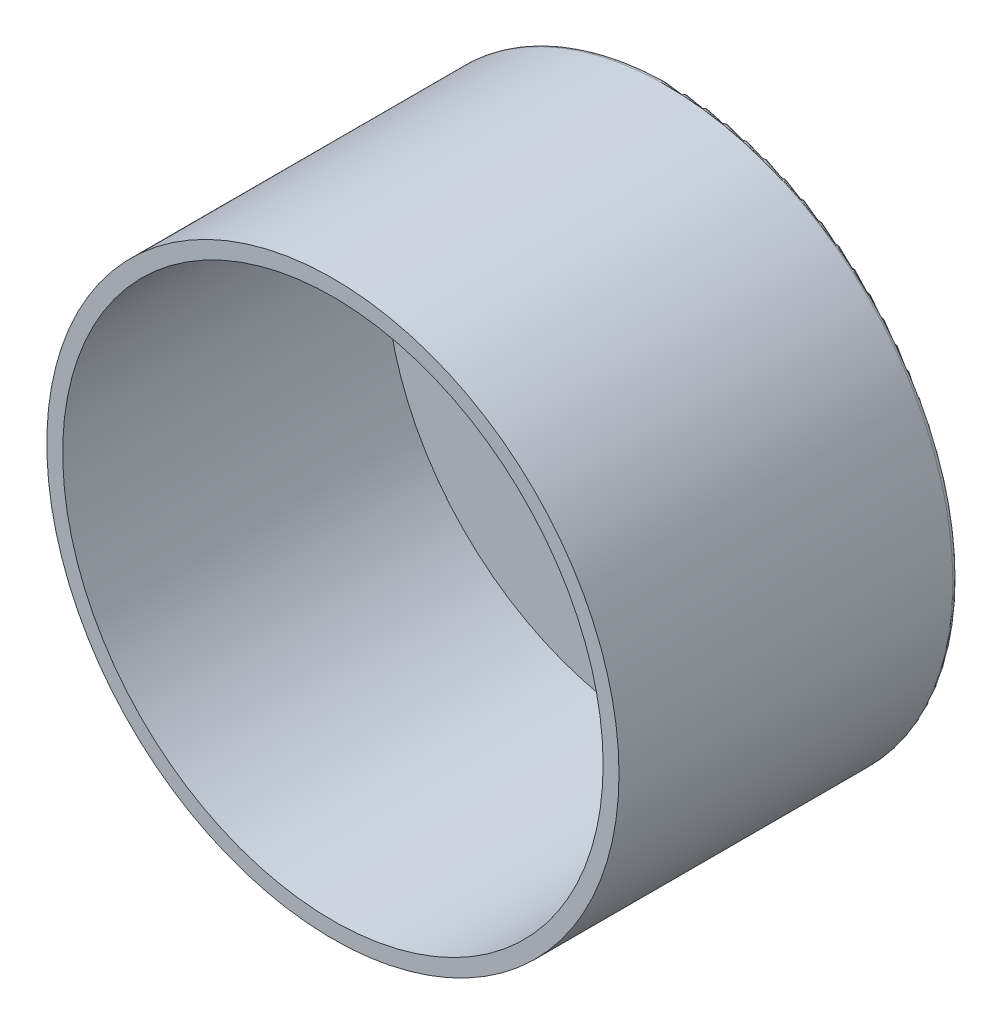
from build123d import *

# Parameters (mm, degrees)
SKETCH1_R           = 27
BOSS_EXTRUDE1_DEPTH = 32
SHELL3_T            = -1.5
FILLET1_R           = 0.5


with BuildPart() as part:
    # Sketch1 → Boss-Extrude1 (new body)
    with BuildSketch(Plane.XY):
        Circle(SKETCH1_R)
    extrude(amount=BOSS_EXTRUDE1_DEPTH)

    # Shell3
    shell3_openings = [part.faces().sort_by_distance(p)[0] for p in [
        (0, 0, 32),
    ]]
    offset(amount=SHELL3_T, openings=shell3_openings, kind=Kind.INTERSECTION)

    # Fillet1
    fillet1_edges = [part.edges().sort_by_distance(p)[0] for p in [
        (-27, 0, 0),
    ]]
    fillet(fillet1_edges, radius=FILLET1_R)


solid = part.part
